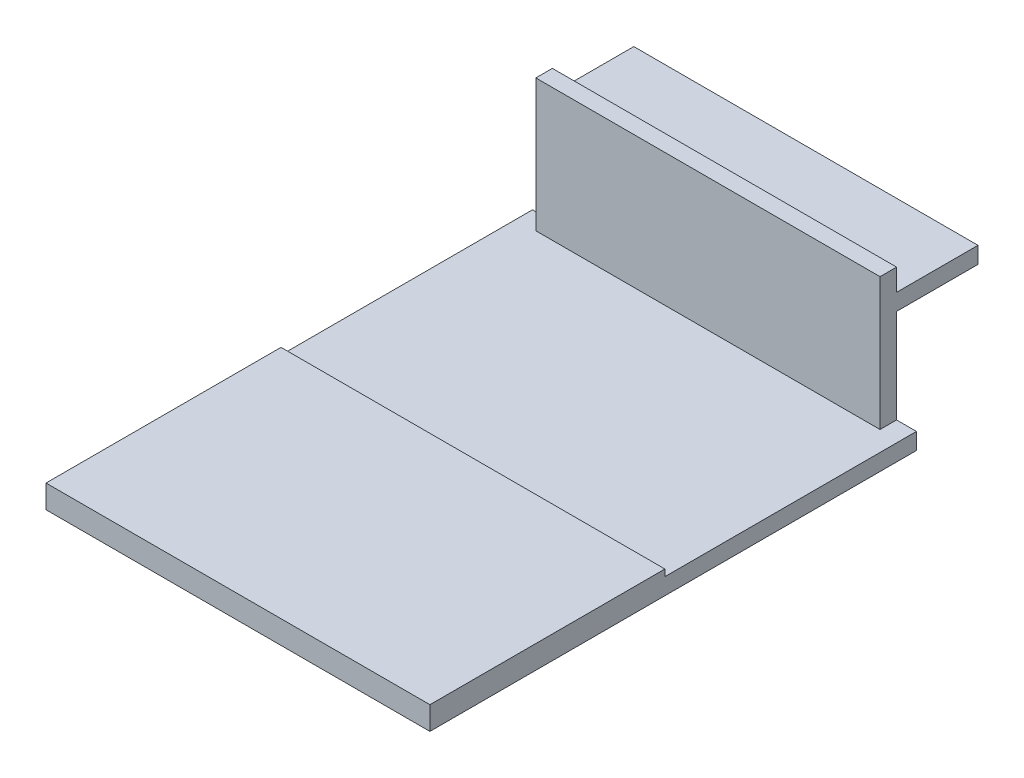
from build123d import *

# Parameters (mm, degrees)
SKETCH1_W           = 132.08
SKETCH1_H           = 57.15
BOSS_EXTRUDE1_DEPTH = 6.35
SKETCH2_W           = 132.08
SKETCH2_H           = 6.35
BOSS_EXTRUDE2_DEPTH = 31.242
SKETCH3_W           = 132.08
SKETCH3_H           = 6.35
BOSS_EXTRUDE3_DEPTH = 180.34
SKETCH4_W           = 7.62
SKETCH4_H           = 186.69
BOSS_EXTRUDE4_DEPTH = 6.35
SKETCH5_W           = 147.32
SKETCH5_H           = 90.17
BOSS_EXTRUDE5_DEPTH = 2.54


with BuildPart() as part:
    # Sketch1 → Boss-Extrude1 (new body)
    with BuildSketch(Plane.XY):
        with Locations((35.892678297, -11.105284376)):
            Rectangle(SKETCH1_W, SKETCH1_H)
    extrude(amount=BOSS_EXTRUDE1_DEPTH)

    # Sketch2 → Boss-Extrude2 (add)
    with BuildSketch(Plane(origin=(0, 0, 0), x_dir=(-1, 0, 0), z_dir=(0, 0, -1))):
        with Locations((-35.892678297, 5.912715624)):
            Rectangle(SKETCH2_W, SKETCH2_H)
    extrude(amount=BOSS_EXTRUDE2_DEPTH)

    # Sketch3 → Boss-Extrude3 (add)
    with BuildSketch(Plane.XY.offset(6.35)):
        with Locations((35.892678297, -36.505284376)):
            Rectangle(SKETCH3_W, SKETCH3_H)
    extrude(amount=BOSS_EXTRUDE3_DEPTH)

    # Sketch4 → Boss-Extrude4 (add)
    with BuildSketch(Plane.XZ.offset(39.680284376)):
        with Locations((-33.957321703, 93.345)):
            Rectangle(SKETCH4_W, SKETCH4_H)
        with Locations((105.742678297, 93.345)):
            Rectangle(SKETCH4_W, SKETCH4_H)
    extrude(amount=-BOSS_EXTRUDE4_DEPTH)

    # Sketch5 → Boss-Extrude5 (add)
    with BuildSketch(Plane(origin=(0, -33.330284376, 0), x_dir=(1, 0, 0), z_dir=(0, 1, 0))):
        with Locations((35.892678297, -141.605)):
            Rectangle(SKETCH5_W, SKETCH5_H)
    extrude(amount=BOSS_EXTRUDE5_DEPTH)


solid = part.part
